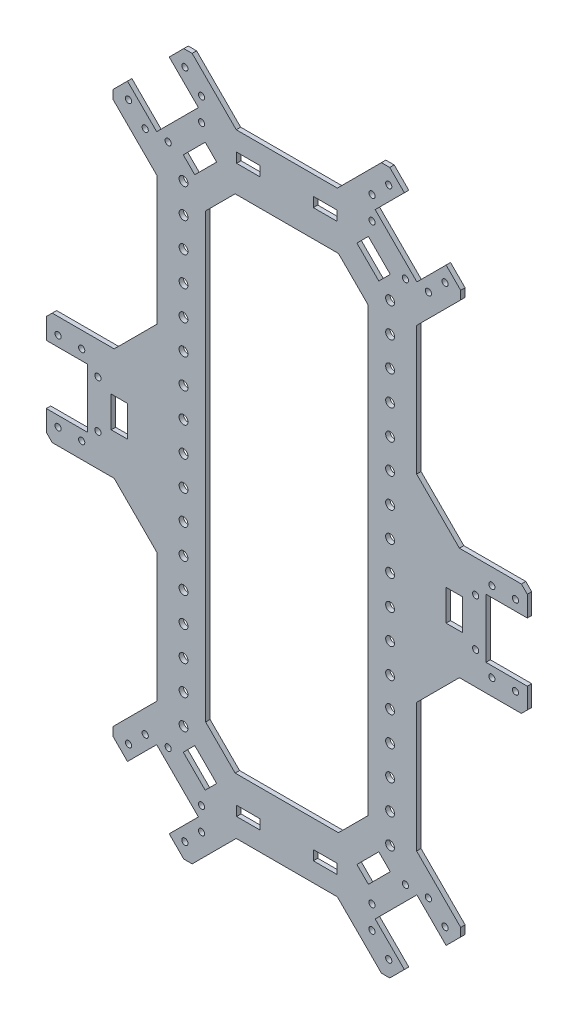
from build123d import *

# Parameters (mm, degrees)
MODEL_R         = 1.05
MODEL_R_2       = 1.5
MODEL_W         = 8
MODEL_H         = 3.3
EXTRUDE_1_DEPTH = 1.5


with BuildPart() as part:
    # Model → Бобышка-Вытянуть1 (new body)
    with BuildSketch(Plane.XY):
        Polygon((-17.129942315, 104), (17.129942315, 104), (32.069282143, 118.939339828), (34.897709268, 118.939339828), (39.847456736, 113.98959236), (29.9479618, 104.090097423), (44.090097423, 89.9479618), (53.98959236, 99.847456736), (58.939339828, 94.897709268), (58.939339828, 92.069282143), (44, 77.129942315), (44, 33.5), (58.5, 19), (79.5, 19), (81.5, 17), (81.5, 10), (67.5, 10), (67.5, -10), (81.5, -10), (81.5, -17), (79.5, -19), (58.5, -19), (44, -33.5), (44, -77.129942315), (58.939339828, -92.069282143), (58.939339828, -94.897709268), (53.98959236, -99.847456736), (44.090097423, -89.9479618), (29.9479618, -104.090097423), (39.847456736, -113.98959236), (34.897709268, -118.939339828), (32.069282143, -118.939339828), (17.129942315, -104), (-17.129942315, -104), (-32.069282143, -118.939339828), (-34.897709268, -118.939339828), (-39.847456736, -113.98959236), (-29.9479618, -104.090097423), (-44.090097423, -89.9479618), (-53.98959236, -99.847456736), (-58.939339828, -94.897709268), (-58.939339828, -92.069282143), (-44, -77.129942315), (-44, -33.5), (-58.5, -19), (-79.5, -19), (-81.5, -17), (-81.5, -10), (-67.5, -10), (-67.5, 10), (-81.5, 10), (-81.5, 17), (-79.5, 19), (-58.5, 19), (-44, 33.5), (-44, 77.129942315), (-58.939339828, 92.069282143), (-58.939339828, 94.897709268), (-53.98959236, 99.847456736), (-44.090097423, 89.9479618), (-29.9479618, 104.090097423), (-39.847456736, 113.98959236), (-34.897709268, 118.939339828), (-32.069282143, 118.939339828), align=None)
        with Locations((-64, 8)):
            Circle(MODEL_R, mode=Mode.SUBTRACT)
        with Locations((-64, -8)):
            Circle(MODEL_R, mode=Mode.SUBTRACT)
        with Locations((-77.5, 13.5)):
            Circle(MODEL_R, mode=Mode.SUBTRACT)
        with Locations((-69.5, 13.5)):
            Circle(MODEL_R, mode=Mode.SUBTRACT)
        with Locations((-77.5, -13.5)):
            Circle(MODEL_R, mode=Mode.SUBTRACT)
        with Locations((-69.5, -13.5)):
            Circle(MODEL_R, mode=Mode.SUBTRACT)
        with Locations((-40.201010127, -88.887301628)):
            Circle(MODEL_R, mode=Mode.SUBTRACT)
        with Locations((-28.887301628, -100.201010127)):
            Circle(MODEL_R, mode=Mode.SUBTRACT)
        with Locations((-53.636038969, -94.544155877)):
            Circle(MODEL_R, mode=Mode.SUBTRACT)
        with Locations((-47.97918472, -88.887301628)):
            Circle(MODEL_R, mode=Mode.SUBTRACT)
        with Locations((-34.544155877, -113.636038969)):
            Circle(MODEL_R, mode=Mode.SUBTRACT)
        with Locations((-28.887301628, -107.97918472)):
            Circle(MODEL_R, mode=Mode.SUBTRACT)
        with Locations((-40.201010127, 88.887301628)):
            Circle(MODEL_R, mode=Mode.SUBTRACT)
        with Locations((-28.887301628, 100.201010127)):
            Circle(MODEL_R, mode=Mode.SUBTRACT)
        with Locations((-53.636038969, 94.544155877)):
            Circle(MODEL_R, mode=Mode.SUBTRACT)
        with Locations((-47.97918472, 88.887301628)):
            Circle(MODEL_R, mode=Mode.SUBTRACT)
        with Locations((-34.544155877, 113.636038969)):
            Circle(MODEL_R, mode=Mode.SUBTRACT)
        with Locations((-28.887301628, 107.97918472)):
            Circle(MODEL_R, mode=Mode.SUBTRACT)
        with Locations((-35, 0)):
            Circle(MODEL_R_2, mode=Mode.SUBTRACT)
        with Locations((-35, 10)):
            Circle(MODEL_R_2, mode=Mode.SUBTRACT)
        with Locations((-35, 20)):
            Circle(MODEL_R_2, mode=Mode.SUBTRACT)
        with Locations((-35, 30)):
            Circle(MODEL_R_2, mode=Mode.SUBTRACT)
        with Locations((-35, 40)):
            Circle(MODEL_R_2, mode=Mode.SUBTRACT)
        with Locations((-35, 50)):
            Circle(MODEL_R_2, mode=Mode.SUBTRACT)
        with Locations((-35, 60)):
            Circle(MODEL_R_2, mode=Mode.SUBTRACT)
        with Locations((-35, 70)):
            Circle(MODEL_R_2, mode=Mode.SUBTRACT)
        with Locations((-35, 80)):
            Circle(MODEL_R_2, mode=Mode.SUBTRACT)
        with Locations((-35, -10)):
            Circle(MODEL_R_2, mode=Mode.SUBTRACT)
        with Locations((-35, -20)):
            Circle(MODEL_R_2, mode=Mode.SUBTRACT)
        with Locations((-35, -30)):
            Circle(MODEL_R_2, mode=Mode.SUBTRACT)
        with Locations((-35, -40)):
            Circle(MODEL_R_2, mode=Mode.SUBTRACT)
        with Locations((-35, -50)):
            Circle(MODEL_R_2, mode=Mode.SUBTRACT)
        with Locations((-35, -60)):
            Circle(MODEL_R_2, mode=Mode.SUBTRACT)
        with Locations((-35, -70)):
            Circle(MODEL_R_2, mode=Mode.SUBTRACT)
        with Locations((-35, -80)):
            Circle(MODEL_R_2, mode=Mode.SUBTRACT)
        with Locations((64, 8)):
            Circle(MODEL_R, mode=Mode.SUBTRACT)
        with Locations((64, -8)):
            Circle(MODEL_R, mode=Mode.SUBTRACT)
        with Locations((77.5, 13.5)):
            Circle(MODEL_R, mode=Mode.SUBTRACT)
        with Locations((69.5, 13.5)):
            Circle(MODEL_R, mode=Mode.SUBTRACT)
        with Locations((77.5, -13.5)):
            Circle(MODEL_R, mode=Mode.SUBTRACT)
        with Locations((69.5, -13.5)):
            Circle(MODEL_R, mode=Mode.SUBTRACT)
        with Locations((40.201010127, -88.887301628)):
            Circle(MODEL_R, mode=Mode.SUBTRACT)
        with Locations((28.887301628, -100.201010127)):
            Circle(MODEL_R, mode=Mode.SUBTRACT)
        with Locations((53.636038969, -94.544155877)):
            Circle(MODEL_R, mode=Mode.SUBTRACT)
        with Locations((47.97918472, -88.887301628)):
            Circle(MODEL_R, mode=Mode.SUBTRACT)
        with Locations((34.544155877, -113.636038969)):
            Circle(MODEL_R, mode=Mode.SUBTRACT)
        with Locations((28.887301628, -107.97918472)):
            Circle(MODEL_R, mode=Mode.SUBTRACT)
        with Locations((40.201010127, 88.887301628)):
            Circle(MODEL_R, mode=Mode.SUBTRACT)
        with Locations((28.887301628, 100.201010127)):
            Circle(MODEL_R, mode=Mode.SUBTRACT)
        with Locations((53.636038969, 94.544155877)):
            Circle(MODEL_R, mode=Mode.SUBTRACT)
        with Locations((47.97918472, 88.887301628)):
            Circle(MODEL_R, mode=Mode.SUBTRACT)
        with Locations((34.544155877, 113.636038969)):
            Circle(MODEL_R, mode=Mode.SUBTRACT)
        with Locations((28.887301628, 107.97918472)):
            Circle(MODEL_R, mode=Mode.SUBTRACT)
        with Locations((35, 0)):
            Circle(MODEL_R_2, mode=Mode.SUBTRACT)
        with Locations((35, 10)):
            Circle(MODEL_R_2, mode=Mode.SUBTRACT)
        with Locations((35, 20)):
            Circle(MODEL_R_2, mode=Mode.SUBTRACT)
        with Locations((35, 30)):
            Circle(MODEL_R_2, mode=Mode.SUBTRACT)
        with Locations((35, 40)):
            Circle(MODEL_R_2, mode=Mode.SUBTRACT)
        with Locations((35, 50)):
            Circle(MODEL_R_2, mode=Mode.SUBTRACT)
        with Locations((35, 60)):
            Circle(MODEL_R_2, mode=Mode.SUBTRACT)
        with Locations((35, 70)):
            Circle(MODEL_R_2, mode=Mode.SUBTRACT)
        with Locations((35, 80)):
            Circle(MODEL_R_2, mode=Mode.SUBTRACT)
        with Locations((35, -10)):
            Circle(MODEL_R_2, mode=Mode.SUBTRACT)
        with Locations((35, -20)):
            Circle(MODEL_R_2, mode=Mode.SUBTRACT)
        with Locations((35, -30)):
            Circle(MODEL_R_2, mode=Mode.SUBTRACT)
        with Locations((35, -40)):
            Circle(MODEL_R_2, mode=Mode.SUBTRACT)
        with Locations((35, -50)):
            Circle(MODEL_R_2, mode=Mode.SUBTRACT)
        with Locations((35, -60)):
            Circle(MODEL_R_2, mode=Mode.SUBTRACT)
        with Locations((35, -70)):
            Circle(MODEL_R_2, mode=Mode.SUBTRACT)
        with Locations((35, -80)):
            Circle(MODEL_R_2, mode=Mode.SUBTRACT)
        Polygon((-27.5, 0), (-27.5, 75), (-17.5, 85), (0, 85), (17.5, 85), (27.5, 75), (27.5, 0), (27.5, -75), (17.5, -85), (0, -85), (-17.5, -85), (-27.5, -75), align=None, mode=Mode.SUBTRACT)
        Polygon((-31.362175362, 91.362175362), (-27.649864761, 95.074485963), (-23.760777464, 91.185398667), (-27.473088065, 87.473088065), (-31.185398667, 83.760777464), (-35.074485963, 87.649864761), align=None, mode=Mode.SUBTRACT)
        Polygon((-31.362175362, -91.362175362), (-27.649864761, -95.074485963), (-23.760777464, -91.185398667), (-27.473088065, -87.473088065), (-31.185398667, -83.760777464), (-35.074485963, -87.649864761), align=None, mode=Mode.SUBTRACT)
        Polygon((-59.5, 0), (-59.5, -5.25), (-54, -5.25), (-54, 0), (-54, 5.25), (-59.5, 5.25), align=None, mode=Mode.SUBTRACT)
        with Locations((-13, 95.85)):
            Rectangle(MODEL_W, MODEL_H, mode=Mode.SUBTRACT)
        with Locations((13, 95.85)):
            Rectangle(MODEL_W, MODEL_H, mode=Mode.SUBTRACT)
        with Locations((-13, -95.85)):
            Rectangle(MODEL_W, MODEL_H, mode=Mode.SUBTRACT)
        with Locations((13, -95.85)):
            Rectangle(MODEL_W, MODEL_H, mode=Mode.SUBTRACT)
        Polygon((31.362175362, 91.362175362), (27.649864761, 95.074485963), (23.760777464, 91.185398667), (27.473088065, 87.473088065), (31.185398667, 83.760777464), (35.074485963, 87.649864761), align=None, mode=Mode.SUBTRACT)
        Polygon((31.362175362, -91.362175362), (27.649864761, -95.074485963), (23.760777464, -91.185398667), (27.473088065, -87.473088065), (31.185398667, -83.760777464), (35.074485963, -87.649864761), align=None, mode=Mode.SUBTRACT)
        Polygon((59.5, 0), (59.5, -5.25), (54, -5.25), (54, 0), (54, 5.25), (59.5, 5.25), align=None, mode=Mode.SUBTRACT)
    extrude(amount=EXTRUDE_1_DEPTH)


solid = part.part
